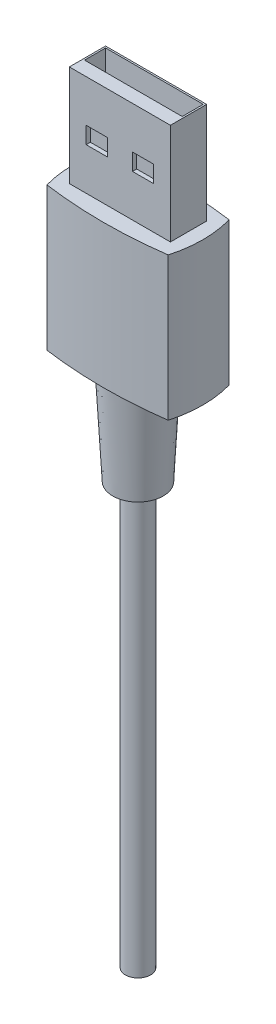
from build123d import *

# Parameters (mm, degrees)
SKETCH1_R           = 1.5
BOSS_EXTRUDE1_DEPTH = 50
SKETCH2_R           = 3.001667429
BOSS_EXTRUDE2_DEPTH = 11.7
BOSS_EXTRUDE2_DRAFT = -3
BOSS_EXTRUDE3_DEPTH = 17
SKETCH10_W          = 12
SKETCH10_H          = 4.3
BOSS_EXTRUDE4_DEPTH = 12
SKETCH11_W          = 11.6
SKETCH11_H          = 2.5
CUT_EXTRUDE1_DEPTH  = 12
SKETCH12_W          = 2.5
SKETCH12_H          = 2
CUT_EXTRUDE2_DEPTH  = 0.5
SKETCH14_W          = 2.5
SKETCH14_H          = 2
CUT_EXTRUDE4_DEPTH  = 0.5
SKETCH16_RX         = 0.950654257
SKETCH16_RY         = 0.480988828
CUT_EXTRUDE5_DEPTH  = 0.5
CUT_EXTRUDE5_TAPER  = 22


with BuildPart() as part:
    # Sketch1 → Boss-Extrude1 (new body)
    with BuildSketch(Plane(origin=(0, 0, 0), x_dir=(1, 0, 0), z_dir=(0, 1, 0))):
        with Locations(Location((0, 0, 0), (0, 0, 270))):
            Circle(SKETCH1_R)
    extrude(amount=BOSS_EXTRUDE1_DEPTH)


with BuildPart() as boss_extrude2_tool:
    # Sketch2 → Boss-Extrude2 (with draft: the straight prism first)
    with BuildSketch(Plane(origin=(0, 50, 0), x_dir=(1, 0, 0), z_dir=(0, 1, 0))):
        Circle(SKETCH2_R)
    extrude(amount=BOSS_EXTRUDE2_DEPTH)
    # Boss-Extrude2: the draft: its side faces are tilted about the plane it starts from
    boss_extrude2_sides = [boss_extrude2_tool.faces().sort_by_distance(p)[0] for p in [
        (-3.001667429, 55.85, 0),
    ]]
    draft(boss_extrude2_sides, Plane(origin=(0, 50, 0), x_dir=(1, 0, 0), z_dir=(0, 1, 0)), BOSS_EXTRUDE2_DRAFT)


with BuildPart() as part_1:
    add(part.part)

    # Boss-Extrude2: add boss_extrude2_tool
    add(boss_extrude2_tool.part)

    # Sketch9 → Boss-Extrude3 (add)
    with BuildSketch(Plane(origin=(0, 61.7, 0), x_dir=(1, 0, 0), z_dir=(0, 1, 0))):
        with BuildLine():
            ThreePointArc((-7.2, 3.614838447), (0, 4.114838447), (7.2, 3.614838447))
            ThreePointArc((7.2, 3.614838447), (7.7, 0), (7.2, -3.614838447))
            ThreePointArc((7.2, -3.614838447), (0, -4.114838447), (-7.2, -3.614838447))
            ThreePointArc((-7.2, -3.614838447), (-7.7, 0), (-7.2, 3.614838447))
        make_face()
    extrude(amount=BOSS_EXTRUDE3_DEPTH)

    # Sketch10 → Boss-Extrude4 (add)
    with BuildSketch(Plane(origin=(0, 78.7, 0), x_dir=(1, 0, 0), z_dir=(0, 1, 0))):
        Rectangle(SKETCH10_W, SKETCH10_H)
    extrude(amount=BOSS_EXTRUDE4_DEPTH)

    # Sketch11 → Cut-Extrude1 (cut)
    with BuildSketch(Plane(origin=(0, 90.7, 0), x_dir=(1, 0, 0), z_dir=(0, 1, 0))):
        with Locations((0, 0.7)):
            Rectangle(SKETCH11_W, SKETCH11_H)
    extrude(amount=-CUT_EXTRUDE1_DEPTH, mode=Mode.SUBTRACT)

    # Sketch12 → Cut-Extrude2 (cut)
    with BuildSketch(Plane.XY.offset(2.15)):
        with Locations((-2.75, 84.7)):
            Rectangle(SKETCH12_W, SKETCH12_H)
        with Locations((2.75, 84.7)):
            Rectangle(SKETCH12_W, SKETCH12_H)
    extrude(amount=-CUT_EXTRUDE2_DEPTH, mode=Mode.SUBTRACT)

    # Sketch14 → Cut-Extrude4 (cut)
    with BuildSketch(Plane(origin=(0, 0, -2.15), x_dir=(-1, 0, 0), z_dir=(0, 0, -1))):
        with Locations((-2.75, 84.7)):
            Rectangle(SKETCH14_W, SKETCH14_H)
        with Locations((2.75, 84.7)):
            Rectangle(SKETCH14_W, SKETCH14_H)
    extrude(amount=-CUT_EXTRUDE4_DEPTH, mode=Mode.SUBTRACT)

    # Sketch16 → Cut-Extrude5 (cut)
    with BuildSketch(Plane(origin=(0, 0, -2.15), x_dir=(-1, 0, 0), z_dir=(0, 0, -1))):
        with Locations((0, 80.942553869)):
            Ellipse(SKETCH16_RX, SKETCH16_RY)
    extrude(amount=-CUT_EXTRUDE5_DEPTH, taper=CUT_EXTRUDE5_TAPER, mode=Mode.SUBTRACT)


solid = part_1.part
